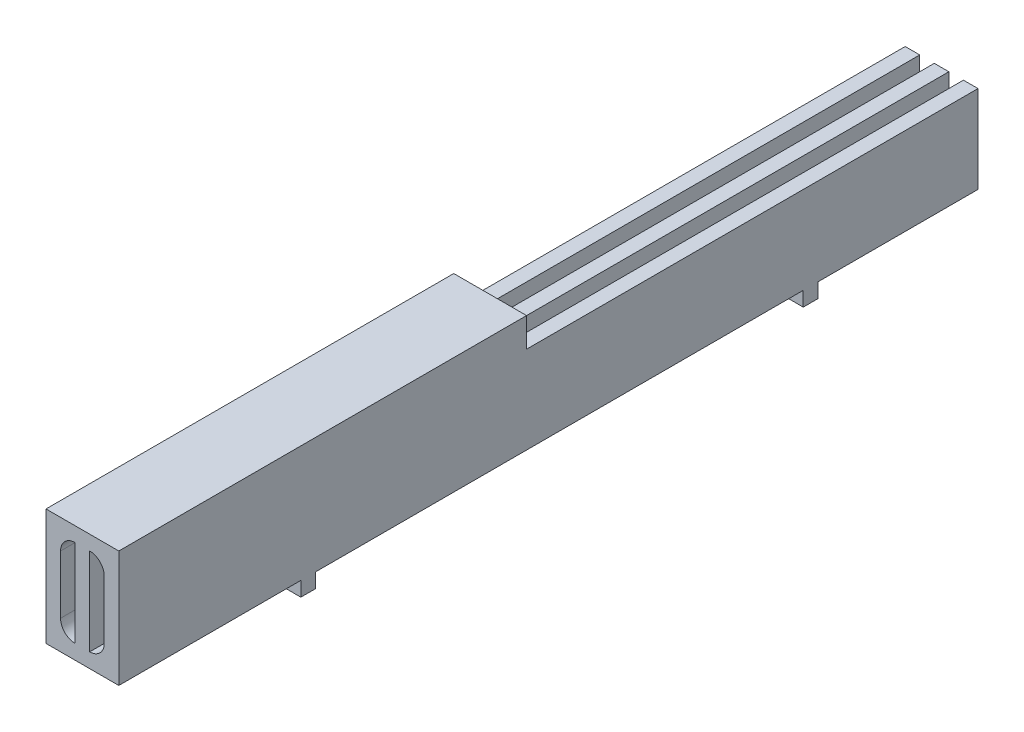
from build123d import *

# Parameters (mm, degrees)
SKETCH1_W           = 5
SKETCH1_H           = 8
BOSS_EXTRUDE3_DEPTH = 59
SKETCH8_W           = 5
SKETCH8_H           = 1
BOSS_EXTRUDE5_DEPTH = 1
SKETCH10_W          = 5
SKETCH10_H          = 1
BOSS_EXTRUDE7_DEPTH = 1
SKETCH6_W           = 5
SKETCH6_H           = 31
CUT_EXTRUDE1_DEPTH  = 2


with BuildPart() as part:
    # Sketch1 → Boss-Extrude3 (new body)
    with BuildSketch(Plane.XY):
        Rectangle(SKETCH1_W, SKETCH1_H)
        with BuildLine():
            Line((-1.5, 2), (-1.5, -2))
            ThreePointArc((-1.5, -2), (-1.207106781, -2.707106781), (-0.5, -3))
            Line((-0.5, -3), (-0.5, 3))
            ThreePointArc((-0.5, 3), (-1.207106781, 2.707106781), (-1.5, 2))
        make_face(mode=Mode.SUBTRACT)
        with BuildLine():
            Line((1.5, 2), (1.5, -2))
            ThreePointArc((1.5, -2), (1.207106781, -2.707106781), (0.5, -3))
            Line((0.5, -3), (0.5, 3))
            ThreePointArc((0.5, 3), (1.207106781, 2.707106781), (1.5, 2))
        make_face(mode=Mode.SUBTRACT)
    extrude(amount=BOSS_EXTRUDE3_DEPTH)

    # Sketch8 → Boss-Extrude5 (add)
    with BuildSketch(Plane.XZ.offset(4)):
        with Locations((0, 11.5)):
            Rectangle(SKETCH8_W, SKETCH8_H)
    extrude(amount=BOSS_EXTRUDE5_DEPTH)

    # Sketch10 → Boss-Extrude7 (add)
    with BuildSketch(Plane.XZ.offset(4)):
        with Locations((0, 46)):
            Rectangle(SKETCH10_W, SKETCH10_H)
    extrude(amount=BOSS_EXTRUDE7_DEPTH)

    # Sketch6 → Cut-Extrude1 (cut)
    with BuildSketch(Plane(origin=(0, 4, 0), x_dir=(1, 0, 0), z_dir=(0, 1, 0))):
        with Locations((0, -15.5)):
            Rectangle(SKETCH6_W, SKETCH6_H)
    extrude(amount=-CUT_EXTRUDE1_DEPTH, mode=Mode.SUBTRACT)


solid = part.part
